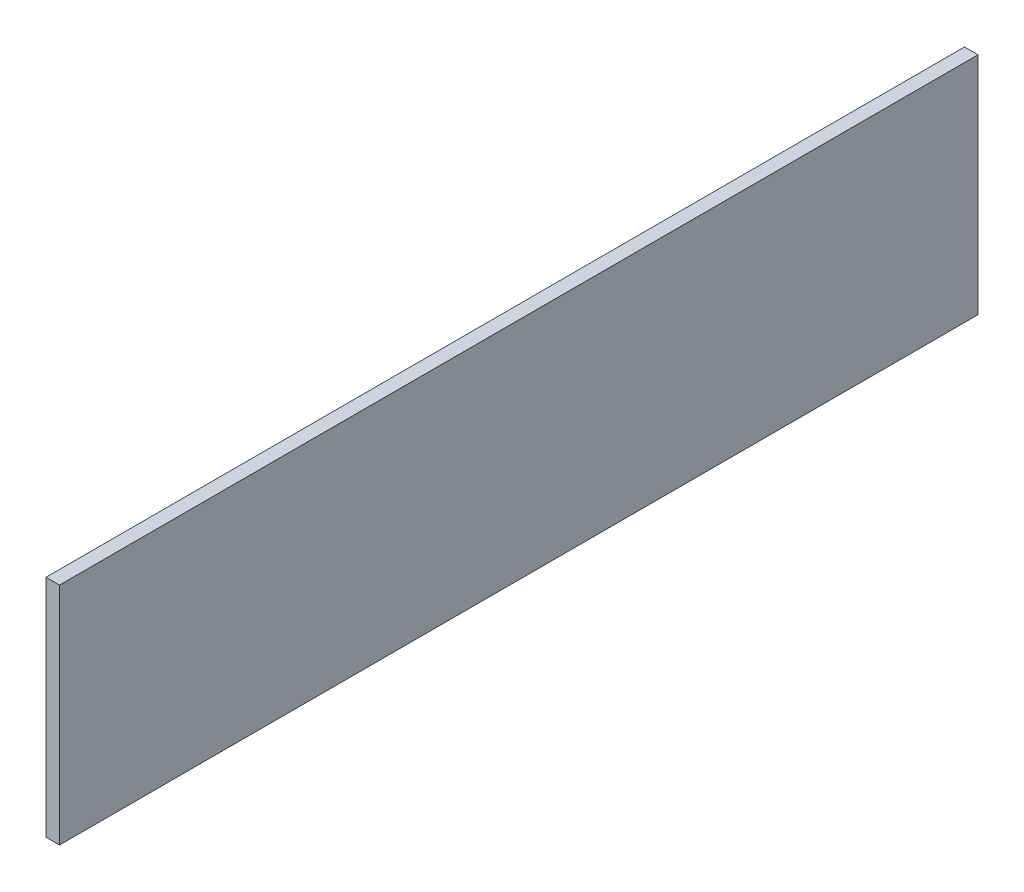
from build123d import *

# Parameters (mm, degrees)
SKETCH1_W           = 204
SKETCH1_H           = 50
BOSS_EXTRUDE2_DEPTH = 3


with BuildPart() as part:
    # Sketch1 → Boss-Extrude2 (new body)
    with BuildSketch(Plane(origin=(0, 0, 0), x_dir=(0, 0, -1), z_dir=(1, 0, 0))):
        with Locations((50.506684492, 18.76671123)):
            Rectangle(SKETCH1_W, SKETCH1_H)
    extrude(amount=BOSS_EXTRUDE2_DEPTH)


solid = part.part
